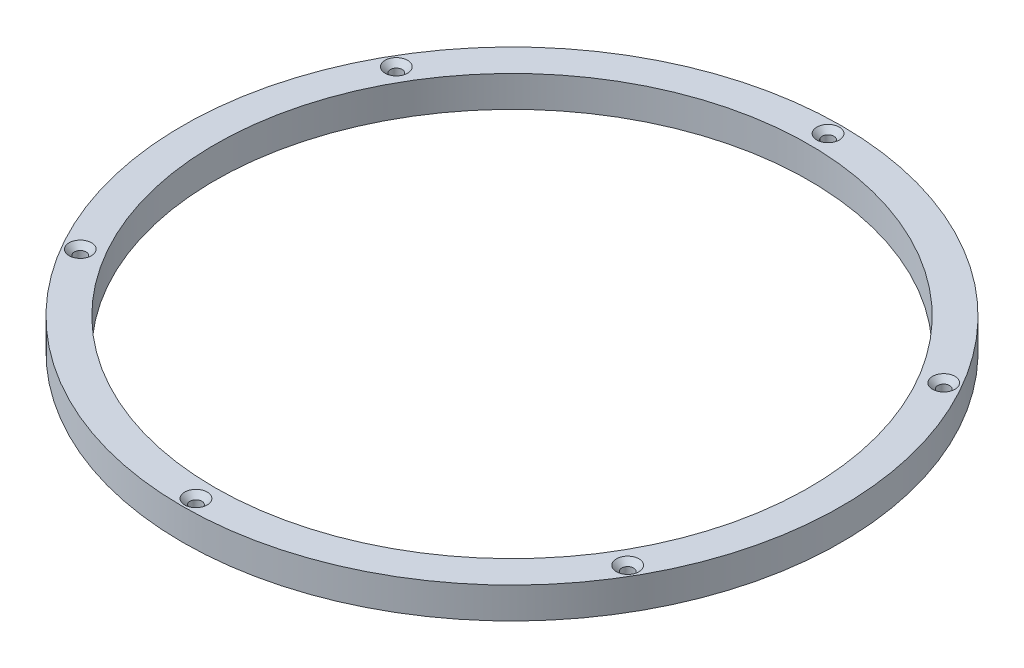
from build123d import *

# Parameters (mm, degrees)
SKETCH1_R                                       = 152.5
SKETCH1_R_2                                     = 137.5
BOSS_EXTRUDE1_DEPTH                             = 14.4
CSK_FOR_M5_FLAT_HEAD_MACHINE_SCREW1_D           = 5.5
CSK_FOR_M5_FLAT_HEAD_MACHINE_SCREW1_CSINK_D     = 10.4
CSK_FOR_M5_FLAT_HEAD_MACHINE_SCREW1_CSINK_ANGLE = 90
CIRPATTERN1_COUNT                               = 6


with BuildPart() as part:
    # Sketch1 → Boss-Extrude1 (new body)
    with BuildSketch(Plane(origin=(0, 0, 0), x_dir=(1, 0, 0), z_dir=(0, 1, 0))):
        with Locations(Location((0, 0, 0), (0, 0, 270))):
            Circle(SKETCH1_R)
        with Locations(Location((0, 0, 0), (0, 0, 270))):
            Circle(SKETCH1_R_2, mode=Mode.SUBTRACT)
    extrude(amount=BOSS_EXTRUDE1_DEPTH)

    # CSK for M5 Flat Head Machine Screw1 (through all)
    with Locations(Plane(origin=(0, 14.4, 0), x_dir=(1, 0, 0), z_dir=(0, 1, 0))):
        with Locations((0, 146.25)):
            csk_for_m5_flat_head_machine_screw1 = CounterSinkHole(CSK_FOR_M5_FLAT_HEAD_MACHINE_SCREW1_D / 2, CSK_FOR_M5_FLAT_HEAD_MACHINE_SCREW1_CSINK_D / 2, counter_sink_angle=CSK_FOR_M5_FLAT_HEAD_MACHINE_SCREW1_CSINK_ANGLE)

    # CirPattern1: CSK for M5 Flat Head Machine Screw1 ×6 about axis
    cirpattern1_axis = Axis((0, 0, 0), (0, 1, 0))
    for i in range(1, CIRPATTERN1_COUNT):
        add(csk_for_m5_flat_head_machine_screw1.rotate(cirpattern1_axis, i * 360 / CIRPATTERN1_COUNT), mode=Mode.SUBTRACT)


solid = part.part
